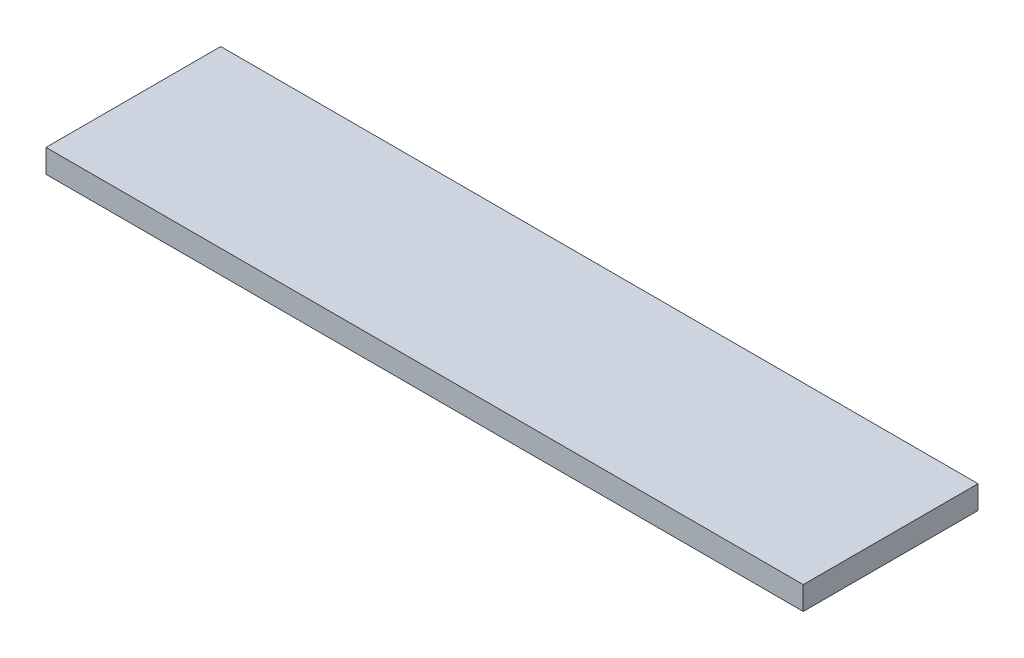
from build123d import *

# Parameters (mm, degrees)
SKETCH1_W           = 325
SKETCH1_H           = 75
BOSS_EXTRUDE1_DEPTH = 10


with BuildPart() as part:
    # Sketch1 → Boss-Extrude1 (new body)
    with BuildSketch(Plane(origin=(0, 0, 0), x_dir=(1, 0, 0), z_dir=(0, 1, 0))):
        Rectangle(SKETCH1_W, SKETCH1_H)
    extrude(amount=BOSS_EXTRUDE1_DEPTH)


solid = part.part
